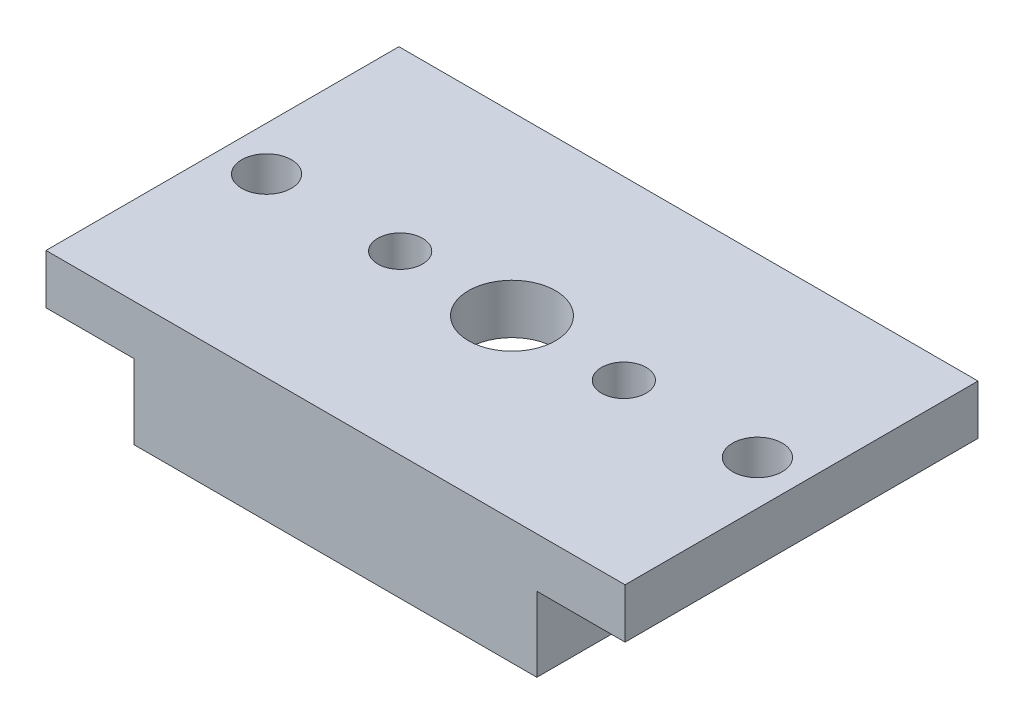
from build123d import *

# Parameters (mm, degrees)
SKETCH_4_W          = 16.2
SKETCH_4_H          = 14.2
SKETCH_4_R          = 0.9
SKETCH_4_R_2        = 1.75
EXTRUDE_1_DEPTH     = 2
SKETCH_4_8_W        = 16.2
SKETCH_4_8_H        = 14.2
SKETCH_4_8_W_2      = 12.2
SKETCH_4_8_H_2      = 10.2
EXTRUDE_2_DEPTH     = 3
SKETCH_5_W          = 23.3
SKETCH_5_H          = 14.2
SKETCH_5_W_2        = 12.2
SKETCH_5_H_2        = 10.2
EXTRUDE_3_DEPTH     = 2
SKETCH_6_R          = 1
CUT_EXTRUDE_1_DEPTH = 14.968983499


with BuildPart() as part:
    # 草图4 → 凸台-拉伸1 (new body)
    with BuildSketch(Plane(origin=(0, 0, 0), x_dir=(1, 0, 0), z_dir=(0, 1, 0))):
        Rectangle(SKETCH_4_W, SKETCH_4_H)
        with Locations((4.5, 0)):
            Circle(SKETCH_4_R, mode=Mode.SUBTRACT)
        with Locations((-4.5, 0)):
            Circle(SKETCH_4_R, mode=Mode.SUBTRACT)
        Circle(SKETCH_4_R_2, mode=Mode.SUBTRACT)
    extrude(amount=EXTRUDE_1_DEPTH)

    # 草图4<8> → 凸台-拉伸2 (add)
    with BuildSketch(Plane(origin=(0, 0, 0), x_dir=(1, 0, 0), z_dir=(0, 1, 0))):
        Rectangle(SKETCH_4_8_W, SKETCH_4_8_H)
        Rectangle(SKETCH_4_8_W_2, SKETCH_4_8_H_2, mode=Mode.SUBTRACT)
    extrude(amount=-EXTRUDE_2_DEPTH)

    # 草图5 → 凸台-拉伸3 (add)
    with BuildSketch(Plane(origin=(0, 2, 0), x_dir=(1, 0, 0), z_dir=(0, 1, 0))):
        Rectangle(SKETCH_5_W, SKETCH_5_H)
        Rectangle(SKETCH_5_W_2, SKETCH_5_H_2, mode=Mode.SUBTRACT)
    extrude(amount=-EXTRUDE_3_DEPTH)

    # 草图6 → 切除-拉伸1 (cut, through all)
    with BuildSketch(Plane(origin=(0, 0, 0), x_dir=(-1, 0, 0), z_dir=(0, -1, 0))):
        with Locations((-9.875, 0)):
            Circle(SKETCH_6_R)
        with Locations((9.875, 0)):
            Circle(SKETCH_6_R)
    extrude(amount=-CUT_EXTRUDE_1_DEPTH, mode=Mode.SUBTRACT)


solid = part.part
